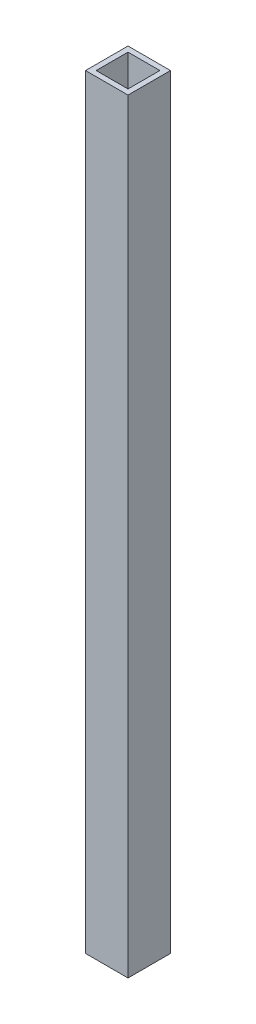
from build123d import *

# Parameters (mm, degrees)
SKETCH1_W           = 25.4
SKETCH1_H           = 25.4
SKETCH1_W_2         = 19.05
SKETCH1_H_2         = 19.05
BOSS_EXTRUDE1_DEPTH = 457.2


with BuildPart() as part:
    # Sketch1 → Boss-Extrude1 (new body)
    with BuildSketch(Plane(origin=(0, 0, 0), x_dir=(1, 0, 0), z_dir=(0, 1, 0))):
        with Locations((12.7, 12.7)):
            Rectangle(SKETCH1_W, SKETCH1_H)
        with Locations((12.7, 12.7)):
            Rectangle(SKETCH1_W_2, SKETCH1_H_2, mode=Mode.SUBTRACT)
    extrude(amount=BOSS_EXTRUDE1_DEPTH)


solid = part.part
